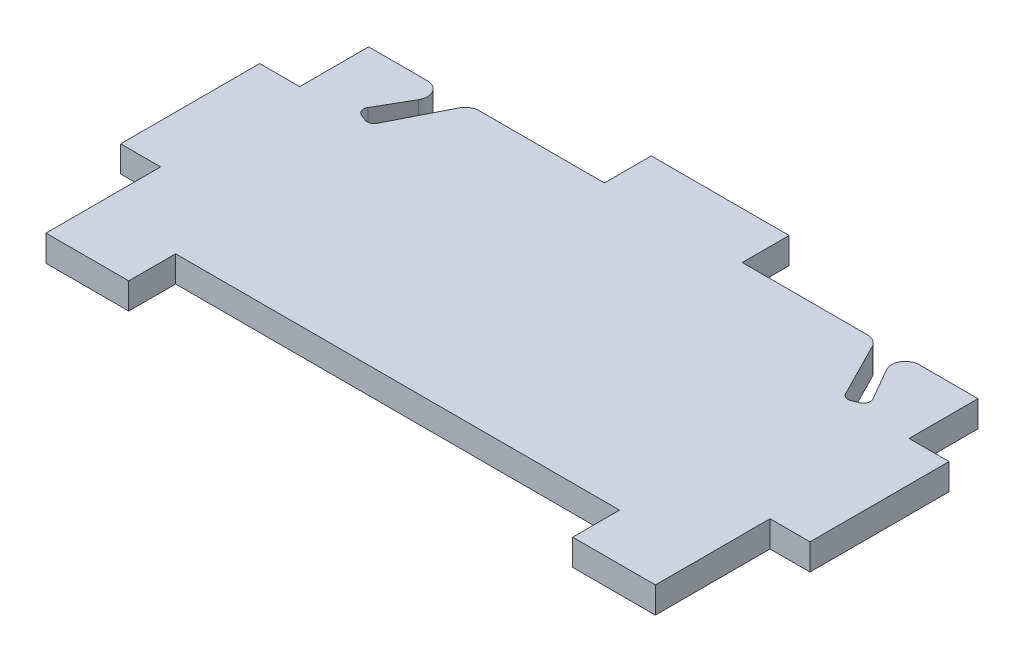
from build123d import *

# Parameters (mm, degrees)
BOSS_EXTRUDE1_DEPTH = 4.826
FILLET1_R           = 1.27
FILLET2_R           = 2.54


with BuildPart() as part:
    # Sketch1 → Boss-Extrude1 (new body)
    with BuildSketch(Plane(origin=(0, 0, 0), x_dir=(1, 0, 0), z_dir=(0, 1, 0))):
        Polygon((-56.134, 29.083), (-40.894, 29.083), (-47.241885042, 18.083256572), (-43.685885042, 16.624574128), (-37.338, 29.083), (-12.7, 29.083), (-12.7, 37.719), (12.7, 37.719), (12.7, 29.083), (37.338, 29.083), (43.685885042, 16.624574128), (47.241885042, 18.083256572), (40.894, 29.083), (56.134, 29.083), (56.134, 16.383), (63.5, 16.383), (63.5, -9.230617291), (56.134, -9.230617291), (56.134, -29.083), (56.134, -30.353), (40.894, -30.353), (40.894, -21.717), (-40.894, -21.717), (-40.894, -30.353), (-56.134, -30.353), (-56.134, -29.083), (-56.134, -9.230617291), (-63.5, -9.230617291), (-63.5, 16.383), (-56.134, 16.383), align=None)
    extrude(amount=BOSS_EXTRUDE1_DEPTH)

    # Fillet1
    fillet1_edges = [part.edges().sort_by_distance(p)[0] for p in [
        (-47.241885042, 2.413, -18.083256572),
        (-43.685885042, 2.413, -16.624574128),
        (43.685885042, 2.413, -16.624574128),
        (47.241885042, 2.413, -18.083256572),
    ]]
    fillet(fillet1_edges, radius=FILLET1_R)

    # Fillet2
    fillet2_edges = [part.edges().sort_by_distance(p)[0] for p in [
        (-40.894, 2.413, -29.083),
        (-37.338, 2.413, -29.083),
        (37.338, 2.413, -29.083),
        (40.894, 2.413, -29.083),
    ]]
    fillet(fillet2_edges, radius=FILLET2_R)


solid = part.part
